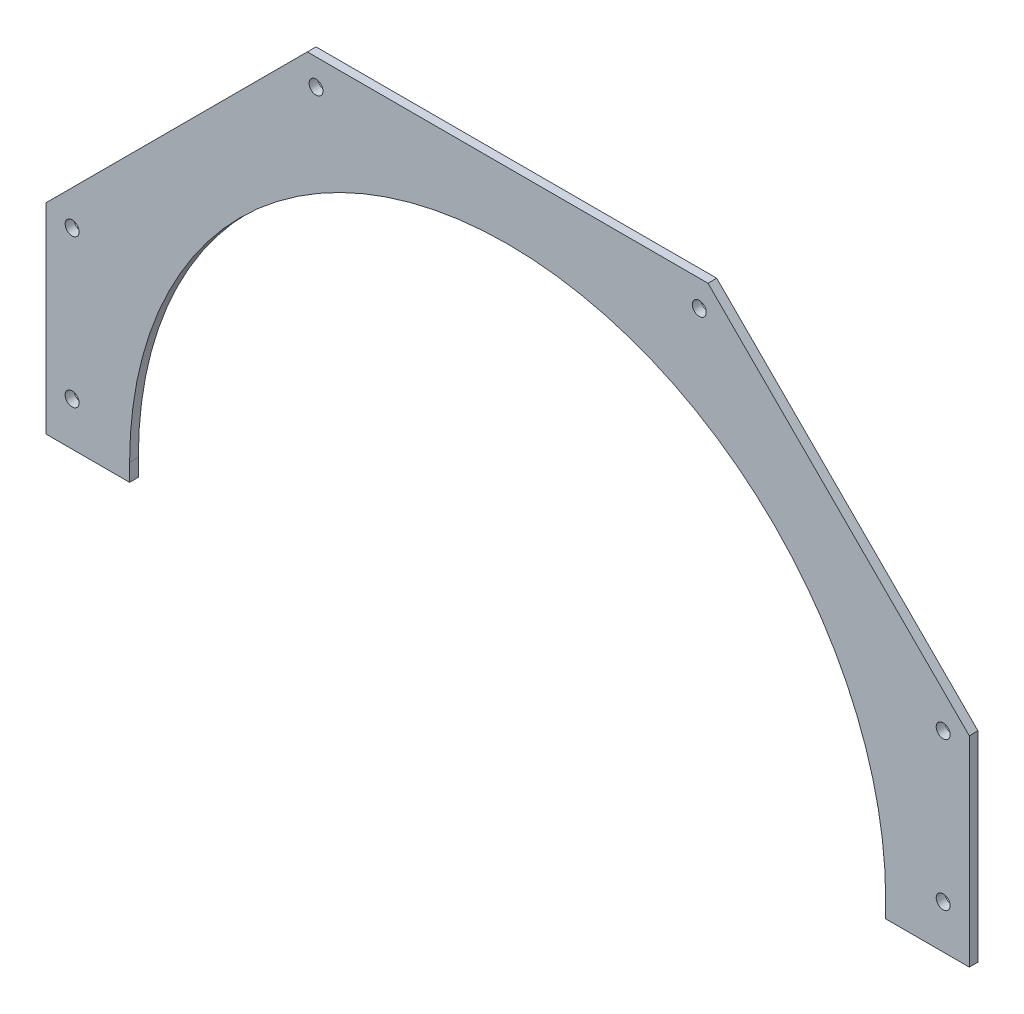
from build123d import *

# Parameters (mm, degrees)
SKETCH_1_W                  = 1060
SKETCH_1_H                  = 530
EXTRUDE_1_DEPTH             = 10
CUT_EXTRUDE_1_DEPTH         = 10
CHAMFER_1_SIZE              = 300
HOLE_WIZARD_16_0_16_1_D     = 16
HOLE_WIZARD_16_0_16_1_DEPTH = 42
HOLE_WIZARD_16_0_16_1_TIP   = 4.806884952


with BuildPart() as part:
    # 草图1 → 凸台-拉伸1 (new body)
    with BuildSketch(Plane.XY):
        with Locations((530, 265)):
            Rectangle(SKETCH_1_W, SKETCH_1_H)
    extrude(amount=EXTRUDE_1_DEPTH)

    # 草图2 → 切除-拉伸1 (cut)
    with BuildSketch(Plane.XY.offset(10)):
        with BuildLine():
            Line((96, 20), (96, 0))
            Line((96, 0), (964, 0))
            Line((964, 0), (964, 20))
            ThreePointArc((964, 20), (530, 454), (96, 20))
        make_face()
    extrude(amount=-CUT_EXTRUDE_1_DEPTH, mode=Mode.SUBTRACT)

    # 倒角1
    chamfer_1_edges = [part.edges().sort_by_distance(p)[0] for p in [
        (0, 530, 5),
        (1060, 530, 5),
    ]]
    chamfer(chamfer_1_edges, length=CHAMFER_1_SIZE)

    # Ø16.0 (16) 直径孔1
    with Locations(Plane.XY.offset(10)):
        with Locations((30, 220), (30, 50), (1030, 220), (1030, 50), (310, 500), (750, 500)):
            Hole(HOLE_WIZARD_16_0_16_1_D / 2, depth=HOLE_WIZARD_16_0_16_1_DEPTH)
            with Locations((0, 0, -(HOLE_WIZARD_16_0_16_1_DEPTH + HOLE_WIZARD_16_0_16_1_TIP / 2))):  # 118° drill point
                Cone(0, HOLE_WIZARD_16_0_16_1_D / 2, HOLE_WIZARD_16_0_16_1_TIP, mode=Mode.SUBTRACT)


solid = part.part
